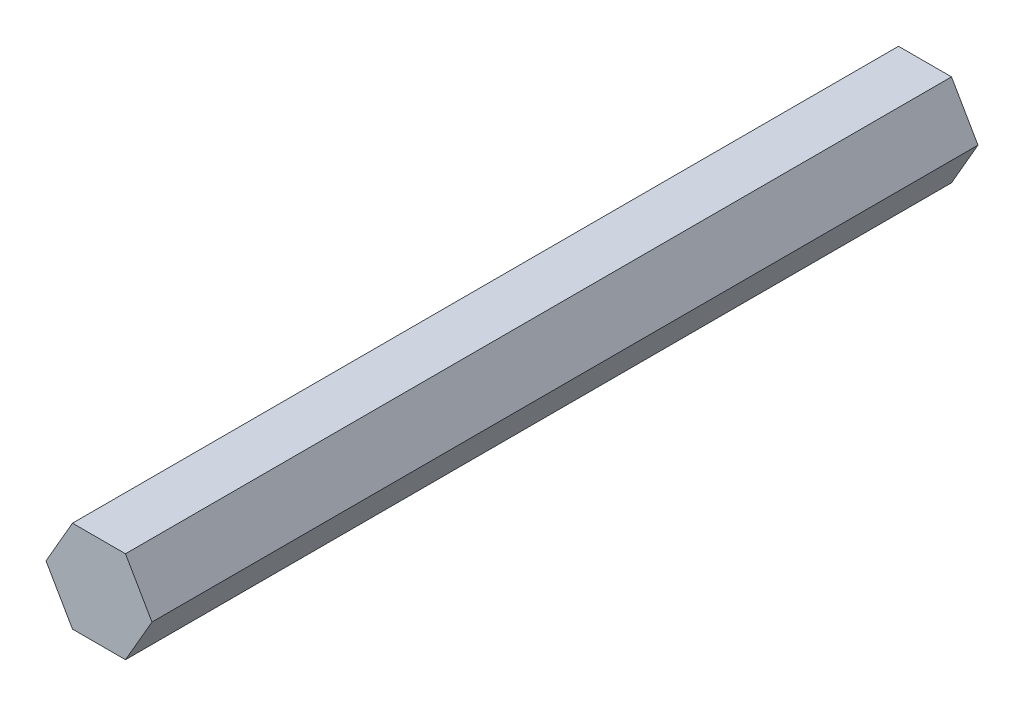
from build123d import *

# Parameters (mm, degrees)
EXTRUSI_N_HEX_PROFILE_DEPTH = 57.15


with BuildPart() as part:
    # Croquis2 → Extrusión Hex Profile (new, symmetric)
    with BuildSketch(Plane.XY):
        Polygon((3.666174209, -6.35), (7.332348419, 0), (3.666174209, 6.35), (-3.666174209, 6.35), (-7.332348419, 0), (-3.666174209, -6.35), align=None)
    extrude(amount=EXTRUSI_N_HEX_PROFILE_DEPTH, both=True)


solid = part.part
